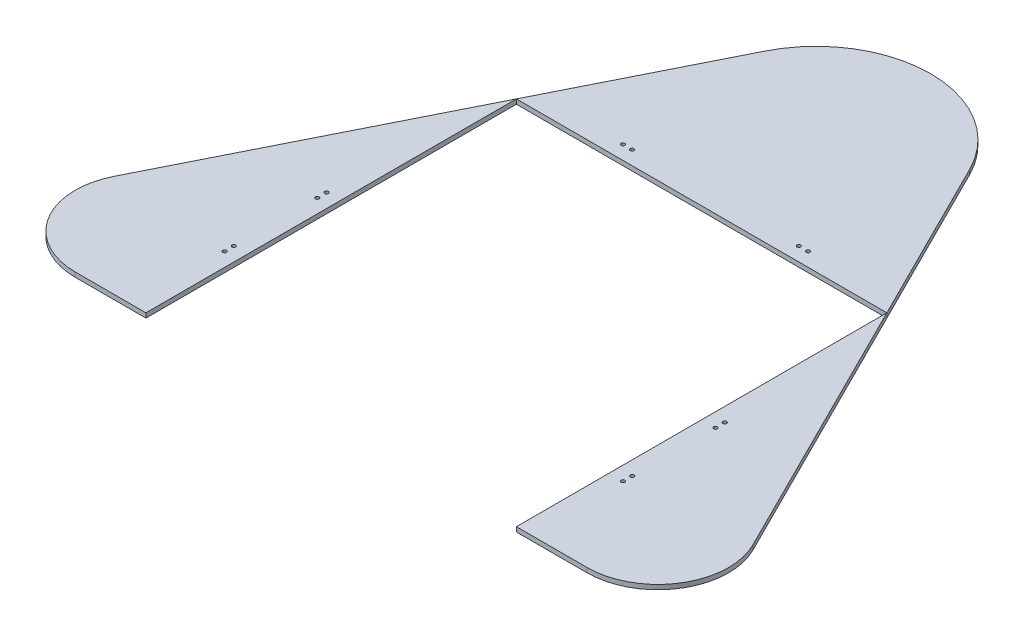
from build123d import *

# Parameters (mm, degrees)
SKETCH_1_W          = 800
SKETCH_1_H          = 800
SKETCH_1_W_2        = 385
SKETCH_1_H_2        = 780
EXTRUDE_1_DEPTH     = 200
SKETCH_2_W          = 800
SKETCH_2_H          = 800
EXTRUDE_2_DEPTH     = 10
EXTRUDE_3_DEPTH     = 10
EXTRUDE_3_2_DEPTH   = 10
SKETCH_4_R          = 4
CUT_EXTRUDE_1_DEPTH = 10
SKETCH_5_R          = 4
CUT_EXTRUDE_2_DEPTH = 10
EXTRUDE_4_DEPTH     = 10
CUT_EXTRUDE_3_REACH = 1087.28
SKETCH_7_R          = 4
CUT_EXTRUDE_4_REACH = 1156.96
SKETCH_8_R          = 4
SKETCH_9_W          = 800
SKETCH_9_H          = 800
CUT_EXTRUDE_5_DEPTH = 1157.647305275


with BuildPart() as part:
    # 草图1 → 凸台-拉伸1 (new body)
    with BuildSketch(Plane(origin=(0, 0, 0), x_dir=(1, 0, 0), z_dir=(0, 1, 0))):
        Rectangle(SKETCH_1_W, SKETCH_1_H)
        with Locations((-197.5, 0)):
            Rectangle(SKETCH_1_W_2, SKETCH_1_H_2, mode=Mode.SUBTRACT)
        with Locations((197.5, 0)):
            Rectangle(SKETCH_1_W_2, SKETCH_1_H_2, mode=Mode.SUBTRACT)
    extrude(amount=EXTRUDE_1_DEPTH)

    # 草图2 → 凸台-拉伸2 (add)
    with BuildSketch(Plane.XZ):
        Rectangle(SKETCH_2_W, SKETCH_2_H)
    extrude(amount=-EXTRUDE_2_DEPTH)

    # 草图4 → 切除-拉伸1 (cut)
    with BuildSketch(Plane.ZY.offset(400)):
        with Locations((180, 160)):
            Circle(SKETCH_4_R)
        with Locations((200, 160)):
            Circle(SKETCH_4_R)
        with Locations((-20, 160)):
            Circle(SKETCH_4_R)
        with Locations((0, 160)):
            Circle(SKETCH_4_R)
    cut_extrude_1 = extrude(amount=-CUT_EXTRUDE_1_DEPTH, mode=Mode.SUBTRACT)


with BuildPart() as body_2:
    # 草图3 → 凸台-拉伸3 (new body)
    with BuildSketch(Plane(origin=(0, 200, 0), x_dir=(1, 0, 0), z_dir=(0, 1, 0))):
        with BuildLine():
            Line((-400, 400), (-400, -400))
            Line((-400, -400), (-552.7864045, -400))
            ThreePointArc((-552.7864045, -400), (-682.754282993, -327.538161854), (-689.4427191, -178.8854382))
            Line((-689.4427191, -178.8854382), (-400, 400))
        make_face()
    extrude(amount=-EXTRUDE_3_DEPTH)

    # 草图5 → 切除-拉伸2 (cut)
    with BuildSketch(Plane(origin=(0, 200, 0), x_dir=(1, 0, 0), z_dir=(0, 1, 0))):
        with Locations(Location((-430, -180, 0), (0, 0, 270))):
            Circle(SKETCH_5_R)
        with Locations(Location((-430, -200, 0), (0, 0, 270))):
            Circle(SKETCH_5_R)
        with Locations(Location((-430, 20, 0), (0, 0, 270))):
            Circle(SKETCH_5_R)
        with Locations(Location((-430, 0, 0), (0, 0, 270))):
            Circle(SKETCH_5_R)
    cut_extrude_2 = extrude(amount=-CUT_EXTRUDE_2_DEPTH, mode=Mode.SUBTRACT)


with BuildPart() as body_3:
    # 草图3 → Extrude 3 2 (new body)
    with BuildSketch(Plane(origin=(0, 200, 0), x_dir=(1, 0, 0), z_dir=(0, 1, 0))):
        with BuildLine():
            Line((689.4427191, -178.8854382), (400, 400))
            Line((400, 400), (400, -400))
            Line((400, -400), (552.7864045, -400))
            ThreePointArc((552.7864045, -400), (682.754282993, -327.538161854), (689.4427191, -178.8854382))
        make_face()
    extrude(amount=-EXTRUDE_3_2_DEPTH)


with BuildPart() as mirror_1_tool:
    # 镜向1: 切除-拉伸1, 切除-拉伸2 across plane
    add(cut_extrude_1.mirror(Plane(origin=(0, 0, 0), x_dir=(0, 0, 1), z_dir=(1, 0, 0))))
    add(cut_extrude_2.mirror(Plane(origin=(0, 0, 0), x_dir=(0, 0, 1), z_dir=(1, 0, 0))))


with BuildPart() as part_1:
    add(part.part)

    # 镜向1: cut by mirror_1_tool
    add(mirror_1_tool.part, mode=Mode.SUBTRACT)


    add(body_2.part)  # 凸台-拉伸4 merges body 2


with BuildPart() as body_3_1:
    add(body_3.part)

    # 镜向1: cut by mirror_1_tool
    add(mirror_1_tool.part, mode=Mode.SUBTRACT)


with BuildPart() as part_2:
    add(part_1.part)

    add(body_3_1.part)  # 凸台-拉伸4 merges body 3
    # 草图6 → 凸台-拉伸4 (add)
    with BuildSketch(Plane(origin=(0, 200, 0), x_dir=(1, 0, 0), z_dir=(0, 1, 0))):
        with BuildLine():
            Line((-400, 400), (-221.1145618, 757.7708764))
            ThreePointArc((-221.1145618, 757.7708764), (0, 894.427191), (221.1145618, 757.7708764))
            Line((221.1145618, 757.7708764), (400, 400))
            Line((400, 400), (-400, 400))
        make_face()
    extrude(amount=-EXTRUDE_4_DEPTH)

    # 草图7 → 切除-拉伸3 (cut, up to next)
    with BuildSketch(Plane(origin=(0, 0, -400), x_dir=(-1, 0, 0), z_dir=(0, 0, -1)), mode=Mode.PRIVATE) as cut_extrude_3_sk1:
        with Locations((-200, 160)):
            Circle(SKETCH_7_R)
    cut_extrude_3_tool1 = extrude(cut_extrude_3_sk1.sketch, amount=-CUT_EXTRUDE_3_REACH, mode=Mode.PRIVATE) & part_2.part
    # 草图7 → 切除-拉伸3 (cut, up to next)
    with BuildSketch(Plane(origin=(0, 0, -400), x_dir=(-1, 0, 0), z_dir=(0, 0, -1)), mode=Mode.PRIVATE) as cut_extrude_3_sk2:
        with Locations((-180, 160)):
            Circle(SKETCH_7_R)
    cut_extrude_3_tool2 = extrude(cut_extrude_3_sk2.sketch, amount=-CUT_EXTRUDE_3_REACH, mode=Mode.PRIVATE) & part_2.part
    cut_extrude_3_1 = cut_extrude_3_tool1.solids().sort_by_distance((200, 160, -400))[0]
    add(cut_extrude_3_1, mode=Mode.SUBTRACT)
    cut_extrude_3_2 = cut_extrude_3_tool2.solids().sort_by_distance((180, 160, -400))[0]
    add(cut_extrude_3_2, mode=Mode.SUBTRACT)
    cut_extrude_3 = cut_extrude_3_1 + cut_extrude_3_2  # 切除-拉伸3 as one shape, for the pattern or mirror that repeats it

    # 草图8 → 切除-拉伸4 (cut, up to next)
    with BuildSketch(Plane.XZ.offset(-190), mode=Mode.PRIVATE) as cut_extrude_4_sk1:
        with Locations(Location((180, -430, 0), (0, 0, 270))):
            Circle(SKETCH_8_R)
    cut_extrude_4_tool1 = extrude(cut_extrude_4_sk1.sketch, amount=-CUT_EXTRUDE_4_REACH, mode=Mode.PRIVATE) & part_2.part
    # 草图8 → 切除-拉伸4 (cut, up to next)
    with BuildSketch(Plane.XZ.offset(-190), mode=Mode.PRIVATE) as cut_extrude_4_sk2:
        with Locations(Location((200, -430, 0), (0, 0, 270))):
            Circle(SKETCH_8_R)
    cut_extrude_4_tool2 = extrude(cut_extrude_4_sk2.sketch, amount=-CUT_EXTRUDE_4_REACH, mode=Mode.PRIVATE) & part_2.part
    cut_extrude_4_1 = cut_extrude_4_tool1.solids().sort_by_distance((180, 190, -430))[0]
    add(cut_extrude_4_1, mode=Mode.SUBTRACT)
    cut_extrude_4_2 = cut_extrude_4_tool2.solids().sort_by_distance((200, 190, -430))[0]
    add(cut_extrude_4_2, mode=Mode.SUBTRACT)
    cut_extrude_4 = cut_extrude_4_1 + cut_extrude_4_2  # 切除-拉伸4 as one shape, for the pattern or mirror that repeats it

    # 镜向2: 切除-拉伸3, 切除-拉伸4 across plane
    add(cut_extrude_3.mirror(Plane(origin=(0, 0, 0), x_dir=(0, 0, 1), z_dir=(1, 0, 0))), mode=Mode.SUBTRACT)
    add(cut_extrude_4.mirror(Plane(origin=(0, 0, 0), x_dir=(0, 0, 1), z_dir=(1, 0, 0))), mode=Mode.SUBTRACT)

    # 草图9 → 切除-拉伸5 (cut, through all)
    with BuildSketch(Plane.XZ):
        Rectangle(SKETCH_9_W, SKETCH_9_H)
    extrude(amount=-CUT_EXTRUDE_5_DEPTH, mode=Mode.SUBTRACT)


with BuildPart() as cut_extrude_5_piece_1:
    # of the separate pieces the step leaves, piece 1, a body of its own (cut_extrude_5_pieces)
    add(part_2.part.solids().sort_by_distance((221.1145618, 190, -757.7708764))[0])


with BuildPart() as cut_extrude_5_piece_2:
    # of the separate pieces the step leaves, piece 2, a body of its own (cut_extrude_5_pieces)
    add(part_2.part.solids().sort_by_distance((-689.4427191, 190, 178.8854382))[0])


with BuildPart() as cut_extrude_5_piece_3:
    # of the separate pieces the step leaves, piece 3, a body of its own (cut_extrude_5_pieces)
    add(part_2.part.solids().sort_by_distance((552.7864045, 190, 400))[0])


solid = Compound([cut_extrude_5_piece_1.part, cut_extrude_5_piece_2.part, cut_extrude_5_piece_3.part])
